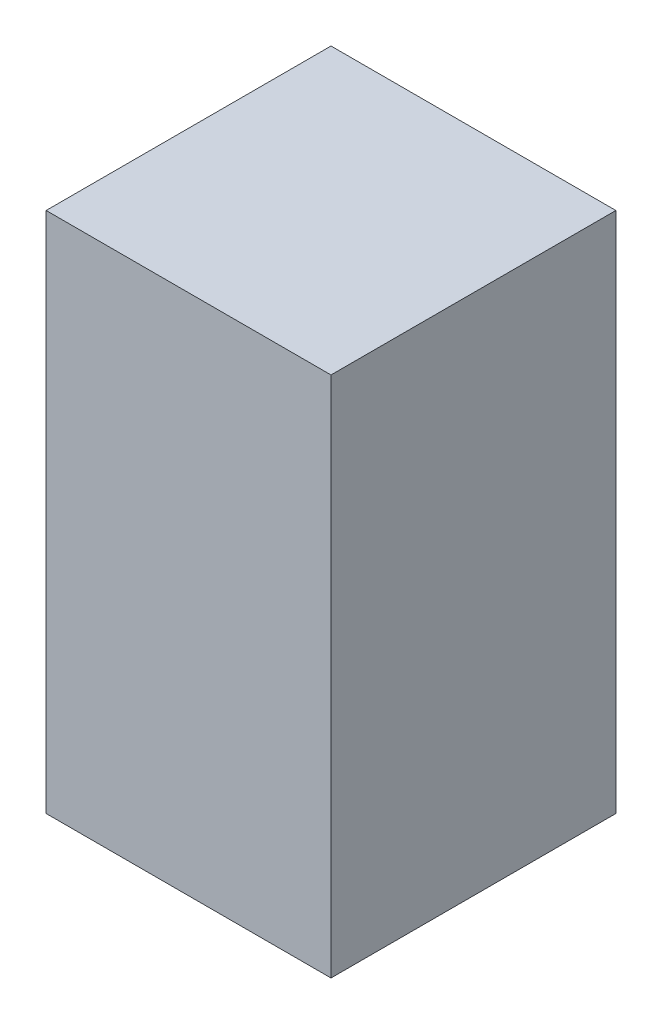
from build123d import *

# Parameters (mm, degrees)
SKETCH1_W           = 12
SKETCH1_H           = 12
BOSS_EXTRUDE1_DEPTH = 22


with BuildPart() as part:
    # Sketch1 → Boss-Extrude1 (new body)
    with BuildSketch(Plane(origin=(0, 0, 0), x_dir=(1, 0, 0), z_dir=(0, 1, 0))):
        with Locations((6, 6)):
            Rectangle(SKETCH1_W, SKETCH1_H)
    extrude(amount=BOSS_EXTRUDE1_DEPTH)


solid = part.part
